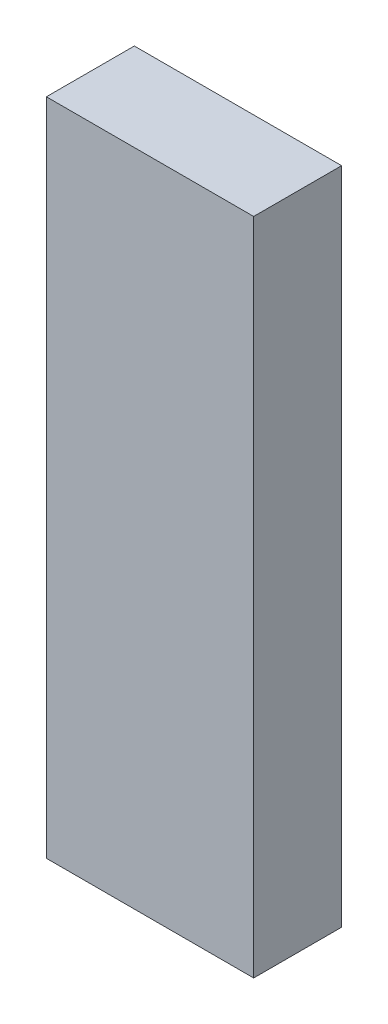
from build123d import *

# Parameters (mm, degrees)
SKETCH1_W           = 33
SKETCH1_H           = 105
BOSS_EXTRUDE1_DEPTH = 14


with BuildPart() as part:
    # Sketch1 → Boss-Extrude1 (new body)
    with BuildSketch(Plane.XY):
        with Locations((16.5, 52.5)):
            Rectangle(SKETCH1_W, SKETCH1_H)
    extrude(amount=BOSS_EXTRUDE1_DEPTH)


solid = part.part
